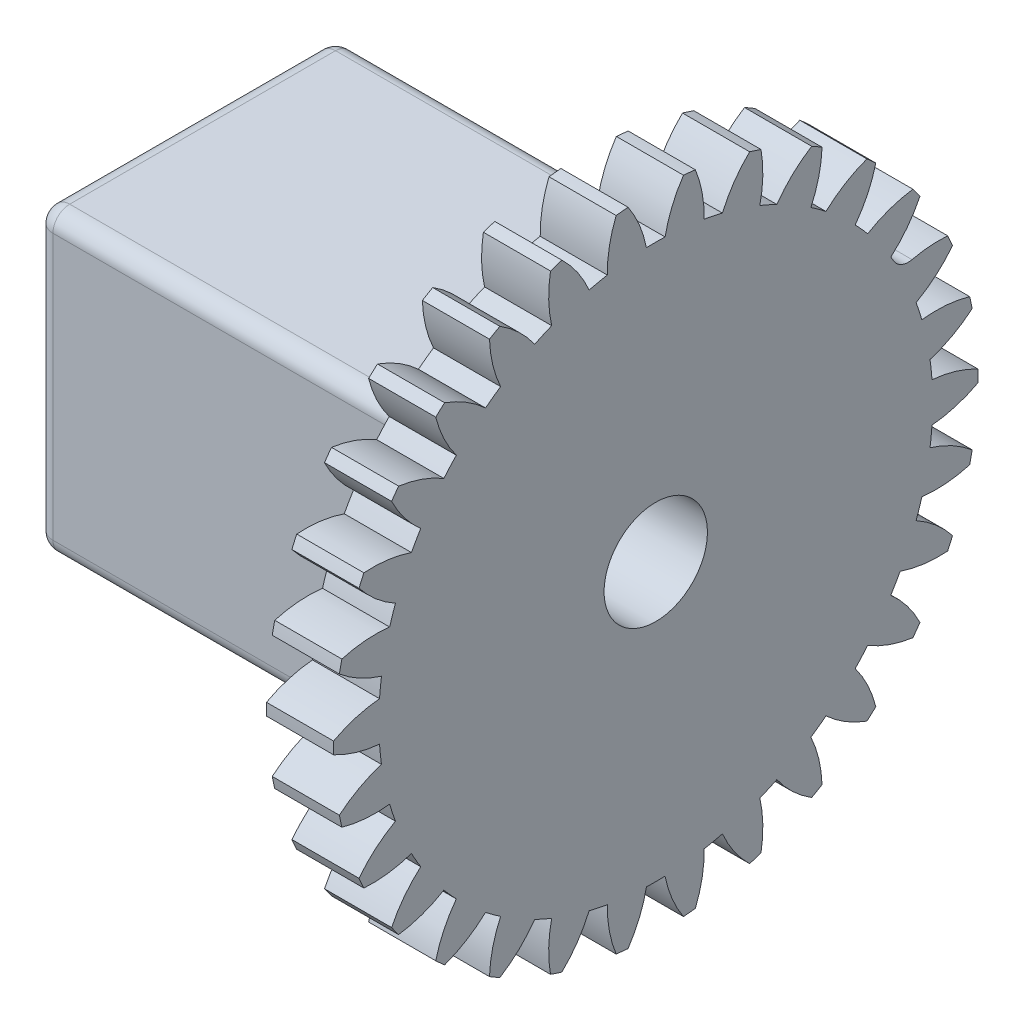
from build123d import *

# Parameters (mm, degrees)
BASPROSKE_W         = 10
BASPROSKE_H         = 48
TOOTHCUT_DEPTH      = 69.614867194
TEETHCUTS_COUNT     = 30
TEETHCUTS_ANGLE     = 348
BORSKE_R            = 5
BORE_DEPTH          = 50.0000508
SKETCH2_W           = 44.6
SKETCH2_H           = 44.6
BOSS_EXTRUDE1_DEPTH = 60
CUT_EXTRUDE1_REACH  = 99.421
SKETCH1_R           = 7.7
FILLET2_R           = 2.5


with BuildPart() as part:
    # BasProSke → Base-Revolve (revolve)
    with BuildSketch(Plane(origin=(0, 0, 0), x_dir=(1, 0, 0), z_dir=(0, 1, 0)), mode=Mode.PRIVATE) as base_revolve_sk:
        with Locations((5, 24)):
            Rectangle(BASPROSKE_W, BASPROSKE_H)
    revolve(base_revolve_sk.sketch.rotate(Axis((-10, 0, 0), (1, 0, 0)), 180), axis=Axis((-10, 0, 0), (1, 0, 0)))

    # TooCutSke → ToothCut (cut, through all)
    with BuildSketch(Plane(origin=(0, 0, 0), x_dir=(0, 0, -1), z_dir=(1, 0, 0))):
        with BuildLine():
            ThreePointArc((1.388358102, 41.225628713), (0, 41.249), (-1.388358102, 41.225628713))
            ThreePointArc((-1.388358102, 41.225628713), (-2.434419088, 44.674608087), (-4.146627223, 47.846050285))
            ThreePointArc((-4.146627223, 47.846050285), (0, 48.0254), (4.146627223, 47.846050285))
            ThreePointArc((4.146627223, 47.846050285), (2.434419088, 44.674608087), (1.388358102, 41.225628713))
        make_face()
    toothcut = extrude(amount=TOOTHCUT_DEPTH, mode=Mode.SUBTRACT)

    # TeethCuts: ToothCut ×30 about axis
    teethcuts_axis = Axis((-10, 0, 0), (1, 0, 0))
    for i in range(1, TEETHCUTS_COUNT):
        add(toothcut.rotate(teethcuts_axis, i * TEETHCUTS_ANGLE / (TEETHCUTS_COUNT - 1)), mode=Mode.SUBTRACT)

    # BorSke → Bore (cut, symmetric)
    with BuildSketch(Plane(origin=(0, 0, 0), x_dir=(0, 0, -1), z_dir=(1, 0, 0))):
        with Locations(Location((0, 0, 0), (0, 0, 180))):
            Circle(BORSKE_R)
    extrude(amount=BORE_DEPTH, both=True, mode=Mode.SUBTRACT)

    # Sketch2 → Boss-Extrude1 (add)
    with BuildSketch(Plane.ZY):
        Rectangle(SKETCH2_W, SKETCH2_H)
    extrude(amount=BOSS_EXTRUDE1_DEPTH)

    # Sketch1 → Cut-Extrude1 (cut, up to next)
    with BuildSketch(Plane(origin=(10, 0, 0), x_dir=(0, 0, -1), z_dir=(1, 0, 0)), mode=Mode.PRIVATE) as cut_extrude1_sk1:
        Circle(SKETCH1_R)
    cut_extrude1_tool1 = extrude(cut_extrude1_sk1.sketch, amount=-CUT_EXTRUDE1_REACH, mode=Mode.PRIVATE) & part.part
    add(cut_extrude1_tool1.solids().sort_by_distance((10, 0, 0))[0], mode=Mode.SUBTRACT)

    # Fillet2
    fillet2_edges = [part.edges().sort_by_distance(p)[0] for p in [
        (5, 19.410460971, -36.396620803),
        (0, 0, -22.3),
        (-30, 22.3, -22.3),
        (0, -22.3, 0),
        (-30, -22.3, -22.3),
        (0, 0, 22.3),
        (-30, -22.3, 22.3),
        (0, 22.3, 0),
        (-30, 22.3, 22.3),
        (-60, 0, -22.3),
        (-60, -22.3, 0),
        (-60, 0, 22.3),
        (-60, 22.3, 0),
        (-60, 0, 7.7),
    ]]
    fillet(fillet2_edges, radius=FILLET2_R)


solid = part.part
